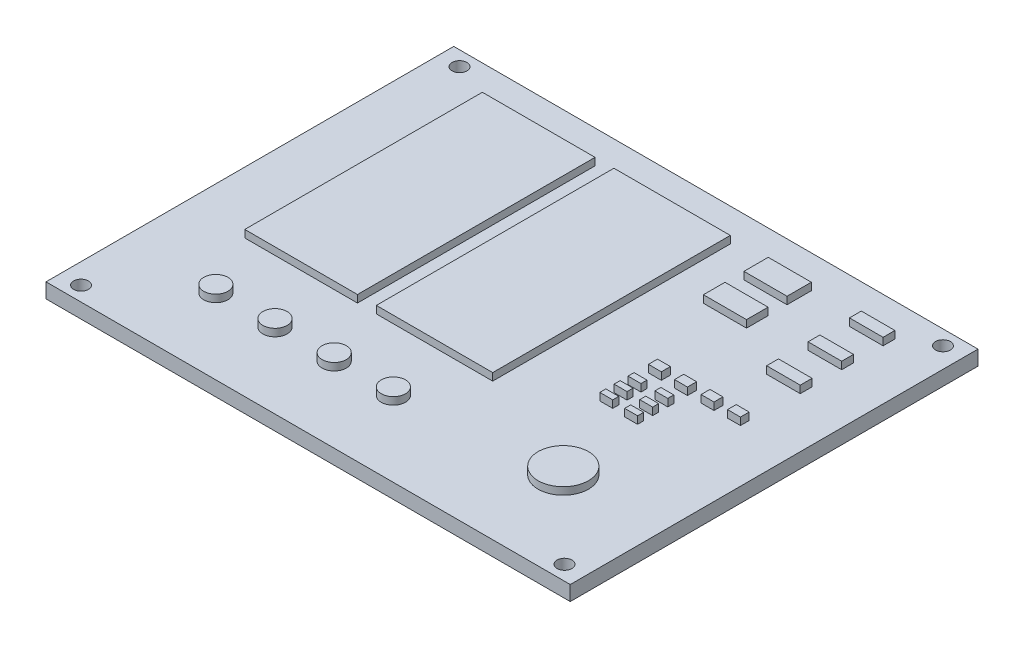
from build123d import *

# Parameters (mm, degrees)
SKETCH1_W               = 90
SKETCH1_H               = 70
BOSS_EXTRUDE1_DEPTH     = 2.54
SKETCH2_R               = 2.074775273
SKETCH2_R_2             = 4.325167344
SKETCH2_W               = 2.219761911
SKETCH2_H               = 1.524543627
SKETCH2_W_2             = 19.349952437
SKETCH2_H_2             = 40.787411984
SKETCH2_W_3             = 19.977857201
SKETCH2_W_4             = 7.399206371
SKETCH2_H_3             = 4.17028531
SKETCH2_H_4             = 3.699603186
SKETCH2_W_5             = 5.771380969
SKETCH2_H_5             = 2.032
SKETCH2_H_6             = 1.035888892
SKETCH2_W_6             = 2.219761912
SKETCH2_H_7             = 1.578831572
SKETCH2_H_8             = 1.553833338
SKETCH2_H_9             = 1.493763587
BOSS_EXTRUDE2_DEPTH     = 1.27
SKETCH3_R               = 1.27
CUT_EXTRUDE1_DEPTH      = 2.54
MIRROR2_COPY_1_SKETCH_R = 1.27
MIRROR2_COPY_1_DEPTH    = 2.54


with BuildPart() as part:
    # Sketch1 → Boss-Extrude1 (new body)
    with BuildSketch(Plane(origin=(0, 0, 0), x_dir=(1, 0, 0), z_dir=(0, 1, 0))):
        Rectangle(SKETCH1_W, SKETCH1_H)
    extrude(amount=BOSS_EXTRUDE1_DEPTH)

    # Sketch2 → Boss-Extrude2 (add)
    with BuildSketch(Plane(origin=(0, 2.54, 0), x_dir=(1, 0, 0), z_dir=(0, 1, 0))):
        with Locations(Location((-28.787636227, -22.056380876, 0), (0, 0, 270))):
            Circle(SKETCH2_R)
        with Locations(Location((-18.627636227, -22.056380876, 0), (0, 0, 270))):
            Circle(SKETCH2_R)
        with Locations(Location((-8.467636227, -22.056380876, 0), (0, 0, 270))):
            Circle(SKETCH2_R)
        with Locations(Location((1.692363773, -22.056380876, 0), (0, 0, 270))):
            Circle(SKETCH2_R)
        with Locations(Location((28.076508074, -19.269666276, 0), (0, 0, 270))):
            Circle(SKETCH2_R_2)
        with Locations((30.364354819, 3.966137277)):
            Rectangle(SKETCH2_W, SKETCH2_H)
        with Locations((-24.784583824, 8.975791822)):
            Rectangle(SKETCH2_W_2, SKETCH2_H_2)
        with Locations((-1.882735108, 8.975791822)):
            Rectangle(SKETCH2_W_3, SKETCH2_H_2)
        with Locations((18.317098286, 27.284355159)):
            Rectangle(SKETCH2_W_4, SKETCH2_H_3)
        with Locations((18.317098286, 20.093760108)):
            Rectangle(SKETCH2_W_4, SKETCH2_H_4)
        with Locations((33.485471346, 28.353497814)):
            Rectangle(SKETCH2_W_5, SKETCH2_H_5)
        with Locations((33.485471346, 21.241497814)):
            Rectangle(SKETCH2_W_5, SKETCH2_H_5)
        with Locations((33.485471346, 14.129497814)):
            Rectangle(SKETCH2_W_5, SKETCH2_H_5)
        with Locations((21.352830995, 0.193252065)):
            Rectangle(SKETCH2_W, SKETCH2_H_6)
        with Locations((25.858592907, 3.938993304)):
            Rectangle(SKETCH2_W_6, SKETCH2_H_7)
        with Locations((21.352830995, 3.951492421)):
            Rectangle(SKETCH2_W, SKETCH2_H_8)
        with Locations((34.870116729, 3.981527297)):
            Rectangle(SKETCH2_W, SKETCH2_H_9)
        with Locations((21.352830995, -2.195488046)):
            Rectangle(SKETCH2_W, SKETCH2_H_6)
        with Locations((21.352830995, -4.651515111)):
            Rectangle(SKETCH2_W, SKETCH2_H_6)
        with Locations((25.858592907, 0.289779343)):
            Rectangle(SKETCH2_W_6, SKETCH2_H_6)
        with Locations((25.858592907, -2.300212834)):
            Rectangle(SKETCH2_W_6, SKETCH2_H_6)
        with Locations((25.858592907, -4.890205011)):
            Rectangle(SKETCH2_W_6, SKETCH2_H_6)
    extrude(amount=BOSS_EXTRUDE2_DEPTH)

    # Sketch3 → Cut-Extrude1 (cut)
    with BuildSketch(Plane(origin=(0, 2.54, 0), x_dir=(1, 0, 0), z_dir=(0, 1, 0))):
        with Locations(Location((-41.49861, 32.4854, 0), (0, 0, 270))):
            Circle(SKETCH3_R)
    cut_extrude1 = extrude(amount=-CUT_EXTRUDE1_DEPTH, mode=Mode.SUBTRACT)

    # Mirror1: Cut-Extrude1 across plane
    add(cut_extrude1.mirror(Plane(origin=(0, 0, 0), x_dir=(1, 0, 0), z_dir=(0, 0, -1))), mode=Mode.SUBTRACT)

    # Mirror2: Cut-Extrude1 across plane
    add(cut_extrude1.mirror(Plane.ZY), mode=Mode.SUBTRACT)

    # Mirror2 copy 1 sketch → Mirror2 copy 1 (cut)
    with BuildSketch(Plane(origin=(0, 2.54, 0), x_dir=(-1, 0, 0), z_dir=(0, 1, 0))):
        with Locations(Location((-41.49861, 32.4854, 0), (0, 0, 270))):
            Circle(MIRROR2_COPY_1_SKETCH_R)
    extrude(amount=-MIRROR2_COPY_1_DEPTH, mode=Mode.SUBTRACT)


solid = part.part
